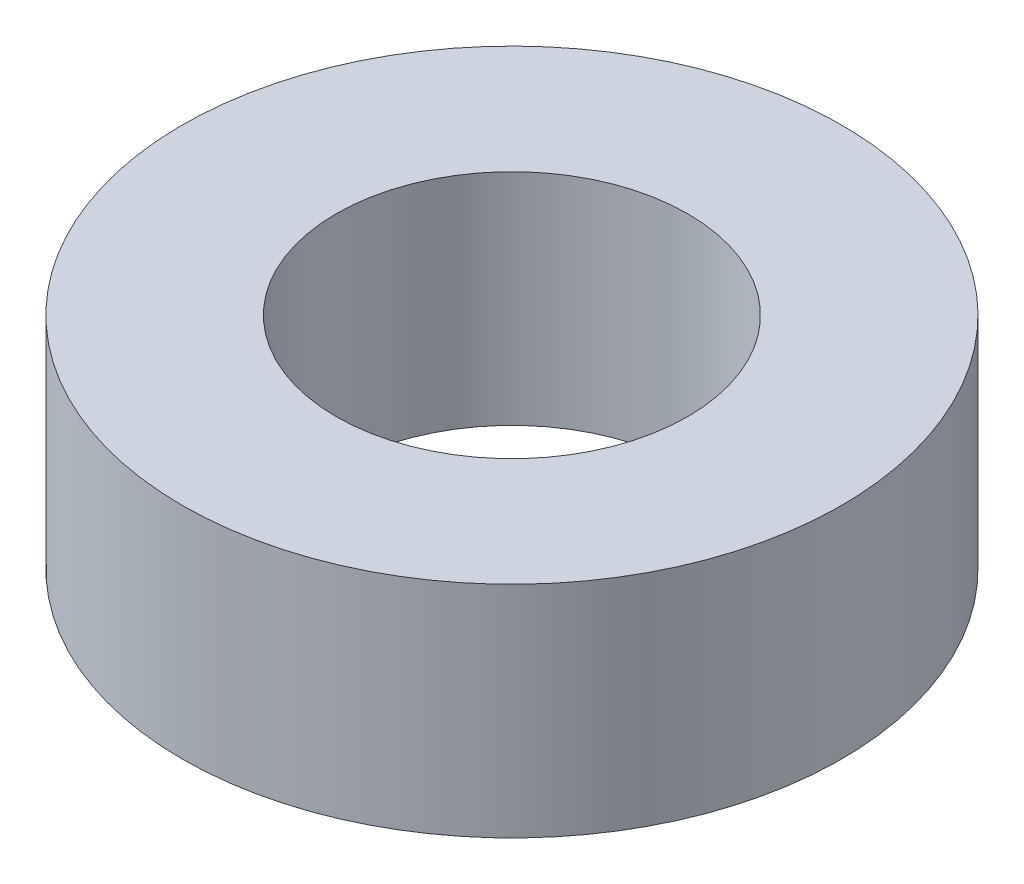
from build123d import *

# Parameters (mm, degrees)
SKETCH1_R           = 3
SKETCH1_R_2         = 1.6
BOSS_EXTRUDE1_DEPTH = 2


with BuildPart() as part:
    # Sketch1 → Boss-Extrude1 (new body)
    with BuildSketch(Plane(origin=(0, 0, 0), x_dir=(1, 0, 0), z_dir=(0, 1, 0))):
        with Locations(Location((0, 0, 0), (0, 0, 270))):
            Circle(SKETCH1_R)
        with Locations(Location((0, 0, 0), (0, 0, 270))):
            Circle(SKETCH1_R_2, mode=Mode.SUBTRACT)
    extrude(amount=BOSS_EXTRUDE1_DEPTH)


solid = part.part
